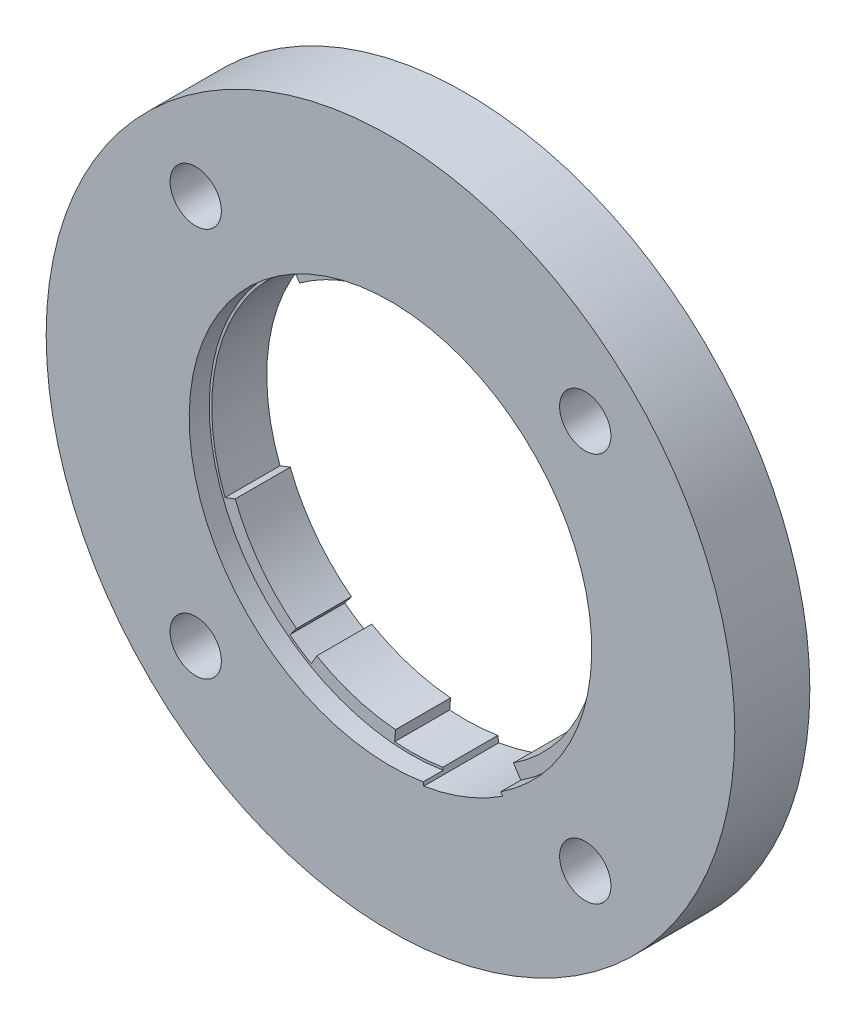
from build123d import *

# Parameters (mm, degrees)
SKETCH2_R               = 2.05
CUT_EXTRUDE1_DEPTH      = 40.350070343
BOSS_EXTRUDE2_DEPTH     = 4.394
CUT_EXTRUDE2_DEPTH      = 40.350070343
CUT_EXTRUDE2_DEPTH_BACK = 40.350070343


with BuildPart() as part:
    # Sketch1 → Revolve1 (revolve)
    with BuildSketch(Plane(origin=(0, 0, 0), x_dir=(1, 0, 0), z_dir=(0, 1, 0)), mode=Mode.PRIVATE) as revolve1_sk:
        Polygon((-15.875, 0), (-27.5, 0), (-27.5, -5.994), (-16.075, -5.994), (-16.075, -4.394), (-15.875, -4.394), align=None)
    revolve(revolve1_sk.sketch.rotate(Axis((0, 0, 1.024477222), (0, 0, -1)), 180), axis=Axis((0, 0, 1.024477222), (0, 0, -1)))

    # Sketch2 → Cut-Extrude1 (cut, through all)
    with BuildSketch(Plane.XY):
        with Locations((-15.556349186, 15.556349186)):
            Circle(SKETCH2_R)
        with Locations((15.556349186, 15.556349186)):
            Circle(SKETCH2_R)
        with Locations((15.556349186, -15.556349186)):
            Circle(SKETCH2_R)
        with Locations((-15.556349186, -15.556349186)):
            Circle(SKETCH2_R)
    extrude(amount=CUT_EXTRUDE1_DEPTH, mode=Mode.SUBTRACT)

    # Sketch3 → Boss-Extrude2 (add)
    with BuildSketch(Plane(origin=(0, 0, 0), x_dir=(-1, 0, 0), z_dir=(0, 0, -1))):
        with BuildLine():
            ThreePointArc((-10.642530671, 11.779310927), (-15.76562668, -1.860279655), (-7.608598211, -13.932869707))
            Line((-7.608598211, -13.932869707), (-7.189226656, -13.164916258))
            ThreePointArc((-7.189226656, -13.164916258), (-14.89665513, -1.757744556), (-10.055934492, 11.130057569))
            Line((-10.055934492, 11.130057569), (-10.642530671, 11.779310927))
        make_face()
        with BuildLine():
            Line((7.924235053, -13.755803278), (7.487466192, -12.997609396))
            ThreePointArc((7.487466192, -12.997609396), (4.450525747, -14.324553067), (1.196324742, -14.952217465))
            Line((1.196324742, -14.952217465), (1.266110352, -15.82443015))
            ThreePointArc((1.266110352, -15.82443015), (4.710139749, -15.160151996), (7.924235053, -13.755803278))
        make_face()
        with BuildLine():
            Line((9.110684324, -11.916183582), (9.642140909, -12.611294291))
            ThreePointArc((9.642140909, -12.611294291), (12.705557645, -9.517585299), (14.81331567, -5.708003492))
            Line((14.81331567, -5.708003492), (13.996833704, -5.393389127))
            ThreePointArc((13.996833704, -5.393389127), (12.005251319, -8.992993983), (9.110684324, -11.916183582))
        make_face()
        with BuildLine():
            ThreePointArc((9.362835646, 12.820020814), (5.987616034, 14.702519486), (2.257535542, 15.713661517))
            Line((2.257535542, 15.713661517), (2.133104449, 14.847554189))
            ThreePointArc((2.133104449, 14.847554189), (5.657589953, 13.892144396), (8.846773838, 12.113405494))
            Line((8.846773838, 12.113405494), (9.362835646, 12.820020814))
        make_face()
    extrude(amount=-BOSS_EXTRUDE2_DEPTH)

    # Sketch4 → Cut-Extrude2 (cut, two sides: drawn at the far end of the back side and taken through both)
    with BuildSketch(Plane(origin=(0, 0, 0), x_dir=(-1, 0, 0), z_dir=(0, 0, -1)).offset(-CUT_EXTRUDE2_DEPTH_BACK)):
        with BuildLine():
            Line((-8.963010633, -13.680627024), (0, 0))
            Line((0, 0), (-2.655754961, -16.138218023))
            ThreePointArc((-2.655754961, -16.138218023), (-5.937917721, -15.239299476), (-8.963010633, -13.680627024))
        make_face()
    extrude(amount=CUT_EXTRUDE2_DEPTH + CUT_EXTRUDE2_DEPTH_BACK, mode=Mode.SUBTRACT)


solid = part.part
